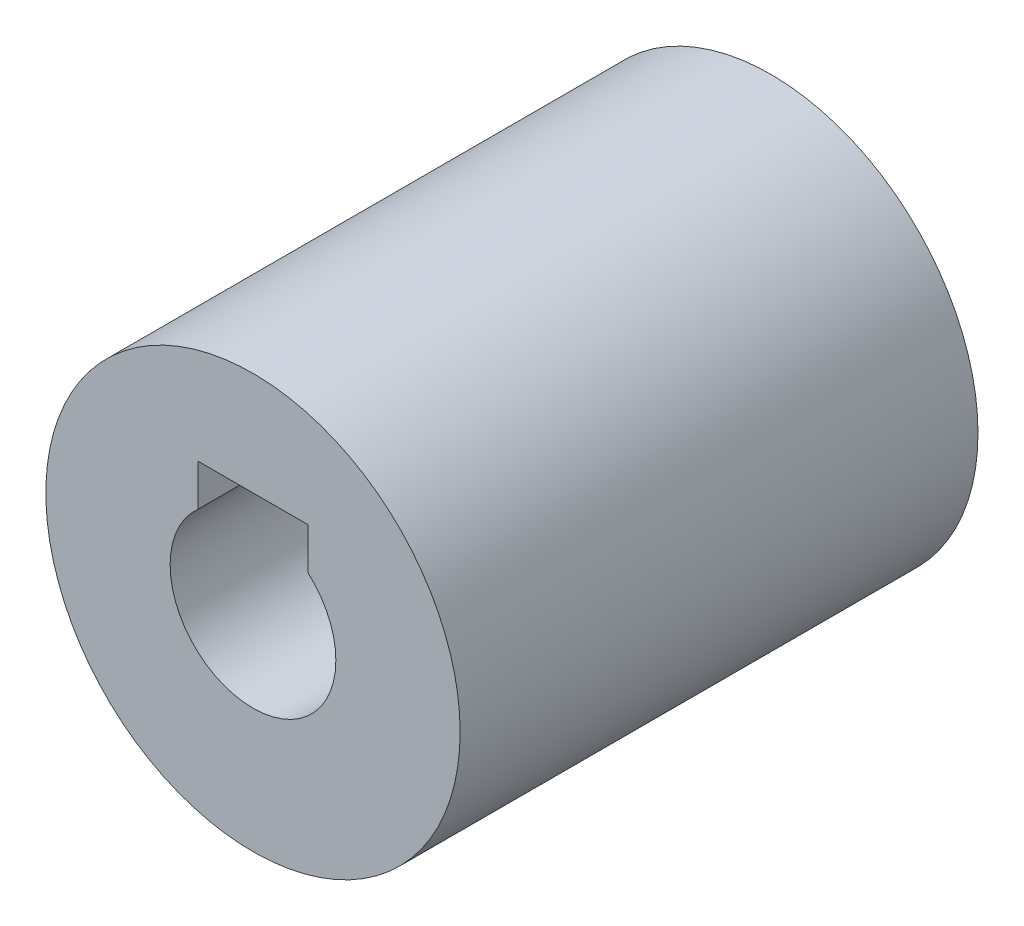
from build123d import *

# Parameters (mm, degrees)
SKETCH1_R           = 10
BOSS_EXTRUDE1_DEPTH = 25


with BuildPart() as part:
    # Sketch1 → Boss-Extrude1 (new body)
    with BuildSketch(Plane.XY):
        Circle(SKETCH1_R)
        with BuildLine():
            ThreePointArc((4, 0), (-1.645751311, -3.645751311), (-2.645751311, 3))
            Line((-2.645751311, 3), (-2.645751311, 5))
            Line((-2.645751311, 5), (2.645751311, 5))
            Line((2.645751311, 5), (2.645751311, 3))
            ThreePointArc((2.645751311, 3), (3.645751311, 1.645751311), (4, 0))
        make_face(mode=Mode.SUBTRACT)
    extrude(amount=BOSS_EXTRUDE1_DEPTH)


solid = part.part
